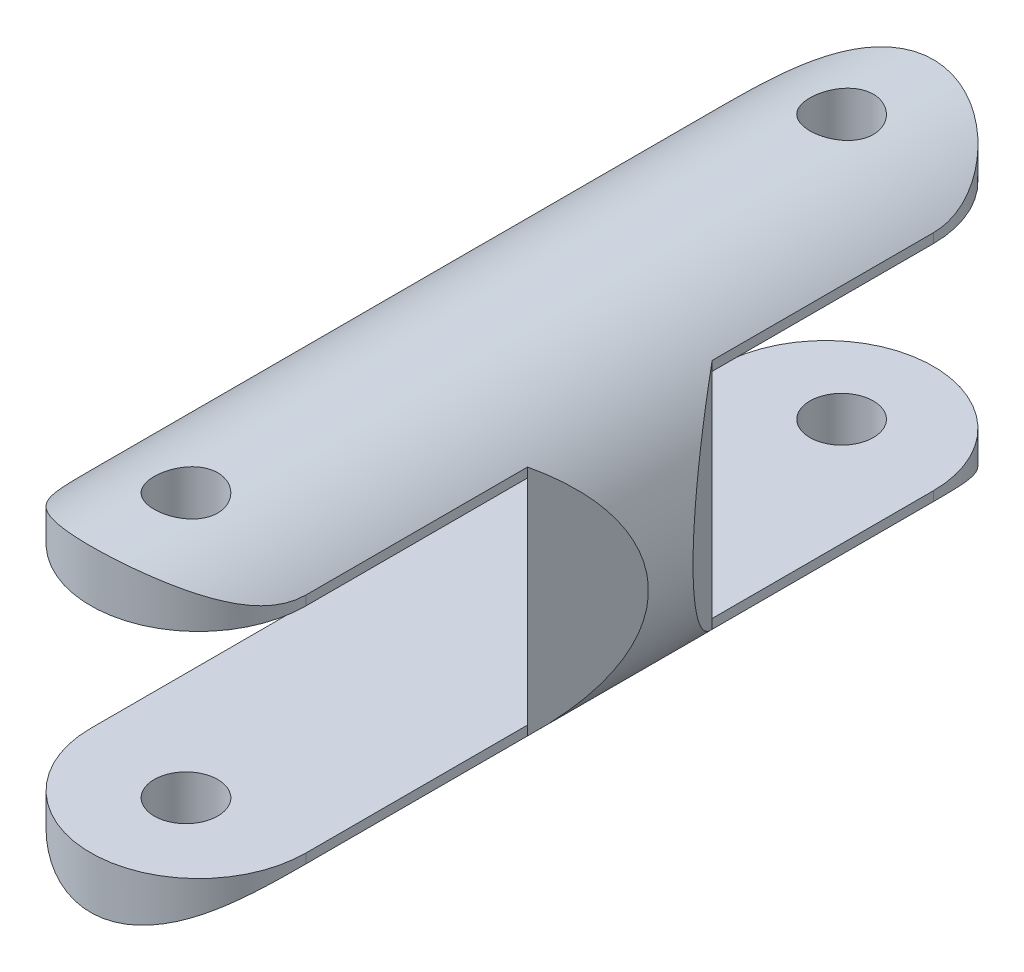
from build123d import *

# Parameters (mm, degrees)
SKETCH1_R               = 37.5
BOSS_EXTRUDE1_DEPTH     = 200
CUT_EXTRUDE1_DEPTH      = 80
CUT_EXTRUDE1_DEPTH_BACK = 99
SKETCH4_W               = 50.94838493
SKETCH4_H               = 50.56593793
CUT_EXTRUDE2_DEPTH      = 250
CUT_EXTRUDE3_DEPTH      = 250
CUT_EXTRUDE3_DEPTH_BACK = 250
SKETCH5_R               = 7.5


with BuildPart() as part:
    # Sketch1 → Boss-Extrude1 (new body)
    with BuildSketch(Plane.XY):
        Circle(SKETCH1_R)
    extrude(amount=BOSS_EXTRUDE1_DEPTH)

    # Sketch3 → Cut-Extrude1 (cut, two sides: drawn at the far end of the back side and taken through both)
    with BuildSketch(Plane(origin=(0, 0, 0), x_dir=(1, 0, 0), z_dir=(0, 1, 0)).offset(-CUT_EXTRUDE1_DEPTH_BACK)):
        with BuildLine():
            Line((-37.5, -200), (37.5, -200))
            Line((37.5, -200), (37.5, -105.272636972))
            Line((37.5, -105.272636972), (25.474192465, -121.813485854))
            Line((25.474192465, -121.813485854), (25.474192465, -174.122397941))
            ThreePointArc((25.474192465, -174.122397941), (0, -199.596590406), (-25.474192465, -174.122397941))
            Line((-25.474192465, -174.122397941), (-25.474192465, -121.813485854))
            Line((-25.474192465, -121.813485854), (-37.5, -105.272636972))
            Line((-37.5, -105.272636972), (-37.5, -200))
        make_face()
        with BuildLine():
            Line((-37.5, 0), (37.5, 0))
            Line((37.5, 0), (37.5, -94.727363028))
            Line((37.5, -94.727363028), (25.474192465, -78.186514146))
            Line((25.474192465, -78.186514146), (25.474192465, -25.906639532))
            ThreePointArc((25.474192465, -25.906639532), (0, -0.432447066), (-25.474192465, -25.906639532))
            Line((-25.474192465, -25.906639532), (-25.474192465, -78.186514146))
            Line((-25.474192465, -78.186514146), (-37.5, -94.727363028))
            Line((-37.5, -94.727363028), (-37.5, 0))
        make_face()
    extrude(amount=CUT_EXTRUDE1_DEPTH + CUT_EXTRUDE1_DEPTH_BACK, mode=Mode.SUBTRACT)

    # Sketch4 → Cut-Extrude2 (cut)
    with BuildSketch(Plane.XY):
        Rectangle(SKETCH4_W, SKETCH4_H)
    extrude(amount=CUT_EXTRUDE2_DEPTH, mode=Mode.SUBTRACT)

    # Sketch5 → Cut-Extrude3 (cut, two sides: drawn at the far end of the back side and taken through both)
    with BuildSketch(Plane(origin=(0, 0, 0), x_dir=(1, 0, 0), z_dir=(0, 1, 0)).offset(-CUT_EXTRUDE3_DEPTH_BACK)):
        with Locations(Location((0, -22.117350407, 0), (0, 0, 90))):
            Circle(SKETCH5_R)
        with Locations(Location((0, -177.068727344, 0), (0, 0, 90))):
            Circle(SKETCH5_R)
    extrude(amount=CUT_EXTRUDE3_DEPTH + CUT_EXTRUDE3_DEPTH_BACK, mode=Mode.SUBTRACT)


solid = part.part
